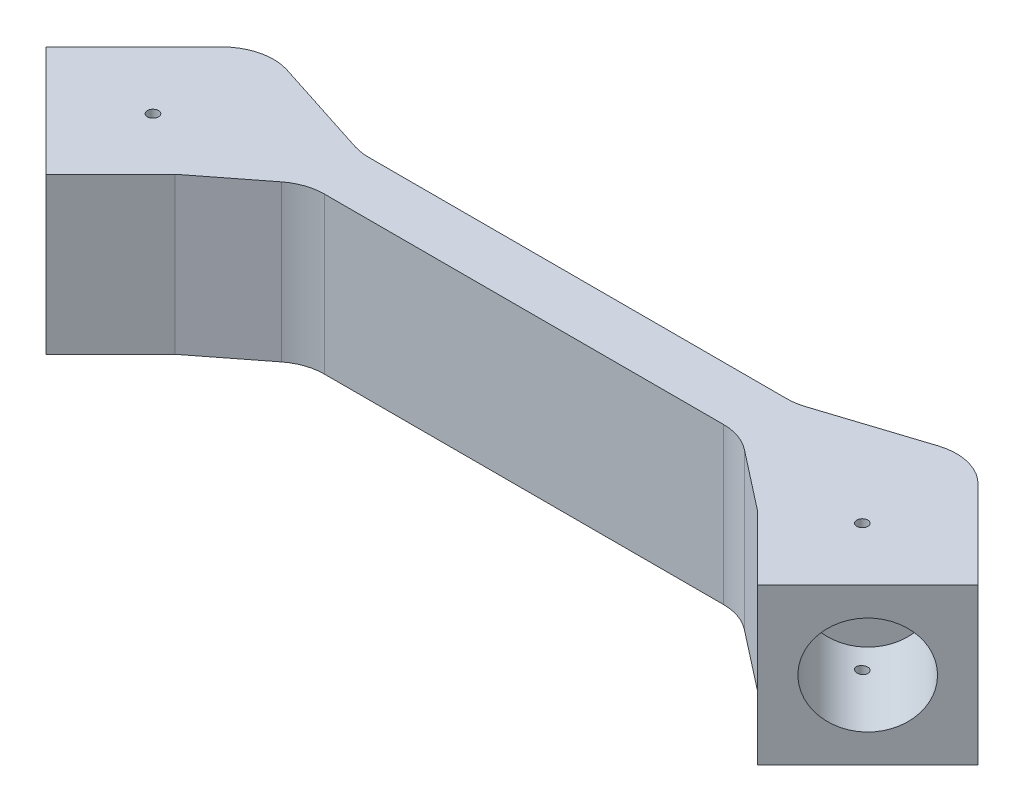
from build123d import *

# Parameters (mm, degrees)
BOSS_EXTRUDE1_DEPTH = 38.1
SKETCH2_R           = 12.065
CUT_EXTRUDE1_DEPTH  = 25.4
SKETCH7_R           = 12.065
CUT_EXTRUDE2_DEPTH  = 25.4
SKETCH9_W           = 26.289
SKETCH9_H           = 26.289
BOSS_EXTRUDE3_DEPTH = 8.89
SKETCH10_R          = 8.0645
CUT_EXTRUDE3_DEPTH  = 6.35
SKETCH12_R          = 6.35
CUT_EXTRUDE5_DEPTH  = 5.08
FILLET1_R           = 12.7
SKETCH13_R          = 1.35
CUT_EXTRUDE6_DEPTH  = 51.816


with BuildPart() as part:
    # Sketch1 → Boss-Extrude1 (new body)
    with BuildSketch(Plane(origin=(0, 0, 0), x_dir=(1, 0, 0), z_dir=(0, 1, 0))):
        with BuildLine():
            Line((-8.394951703, 35.720764917), (16.107614613, 27.828435078))
            ThreePointArc((16.107614613, 27.828435078), (18.03059142, 27.370657964), (20.001310729, 27.216823331))
            Line((20.001310729, 27.216823331), (122.238689271, 27.216823331))
            ThreePointArc((122.238689271, 27.216823331), (124.20940858, 27.370657964), (126.132385387, 27.828435078))
            Line((126.132385387, 27.828435078), (150.634951703, 35.720764917))
            ThreePointArc((150.634951703, 35.720764917), (157.509150211, 35.977683688), (163.508903941, 32.612632786))
            Line((163.508903941, 32.612632786), (184.96230509, 11.159231637))
            Line((184.96230509, 11.159231637), (158.021536726, -15.781536726))
            Line((158.021536726, -15.781536726), (142.24, 0))
            Line((142.24, 0), (127.676821583, 11.356327171))
            ThreePointArc((127.676821583, 11.356327171), (123.996342172, 13.351360126), (119.867179962, 14.041363479))
            Line((119.867179962, 14.041363479), (22.372820038, 14.041363479))
            ThreePointArc((22.372820038, 14.041363479), (18.243657828, 13.351360126), (14.563178417, 11.356327171))
            Line((14.563178417, 11.356327171), (0, 0))
            Line((0, 0), (-15.781536726, -15.781536726))
            Line((-15.781536726, -15.781536726), (-42.72230509, 11.159231637))
            Line((-42.72230509, 11.159231637), (-21.268903941, 32.612632786))
            ThreePointArc((-21.268903941, 32.612632786), (-15.269150211, 35.977683688), (-8.394951703, 35.720764917))
        make_face()
    extrude(amount=BOSS_EXTRUDE1_DEPTH)

    # Sketch2 → Cut-Extrude1 (cut)
    with BuildSketch(Plane(origin=(-15.781536726, 0, 15.781536726), x_dir=(0.7071067811865477, 0, 0.7071067811865475), z_dir=(-0.7071067811865475, 0, 0.7071067811865477))):
        with Locations((-19.05, 19.05)):
            Circle(SKETCH2_R)
    extrude(amount=-CUT_EXTRUDE1_DEPTH, mode=Mode.SUBTRACT)

    # Sketch7 → Cut-Extrude2 (cut)
    with BuildSketch(Plane(origin=(86.901536726, 0, 86.901536726), x_dir=(0.7071067811865472, 0, -0.7071067811865478), z_dir=(0.7071067811865478, 0, 0.7071067811865472))):
        with Locations((119.628868556, 19.05)):
            Circle(SKETCH7_R)
    extrude(amount=-CUT_EXTRUDE2_DEPTH, mode=Mode.SUBTRACT)

    # Sketch9 → Boss-Extrude3 (add)
    with BuildSketch(Plane(origin=(0, 0, -27.216823331), x_dir=(-1, 0, 0), z_dir=(0, 0, -1))):
        with Locations((-71.12, 13.1445)):
            Rectangle(SKETCH9_W, SKETCH9_H)
    extrude(amount=BOSS_EXTRUDE3_DEPTH)

    # Sketch10 → Cut-Extrude3 (cut)
    with BuildSketch(Plane(origin=(0, 0, -36.106823331), x_dir=(-1, 0, 0), z_dir=(0, 0, -1))):
        with Locations((-71.12, 13.1445)):
            Circle(SKETCH10_R)
    extrude(amount=-CUT_EXTRUDE3_DEPTH, mode=Mode.SUBTRACT)

    # Sketch12 → Cut-Extrude5 (cut)
    with BuildSketch(Plane(origin=(0, 0, -29.756823331), x_dir=(-1, 0, 0), z_dir=(0, 0, -1))):
        with Locations((-71.12, 13.1445)):
            Circle(SKETCH12_R)
    extrude(amount=-CUT_EXTRUDE5_DEPTH, mode=Mode.SUBTRACT)

    # Fillet1
    fillet1_edges = [part.edges().sort_by_distance(p)[0] for p in [
        (57.9755, 26.289, -31.661823331),
        (84.2645, 26.289, -31.661823331),
    ]]
    fillet(fillet1_edges, radius=FILLET1_R)

    # Sketch13 → Cut-Extrude6 (cut)
    with BuildSketch(Plane(origin=(0, 38.1, 0), x_dir=(1, 0, 0), z_dir=(0, 1, 0))):
        with Locations(Location((-15.525343469, 10.098073481, 0), (0, 0, 270))):
            Circle(SKETCH13_R)
        with Locations(Location((157.765343469, 10.098073481, 0), (0, 0, 270))):
            Circle(SKETCH13_R)
    extrude(amount=-CUT_EXTRUDE6_DEPTH, mode=Mode.SUBTRACT)


solid = part.part
